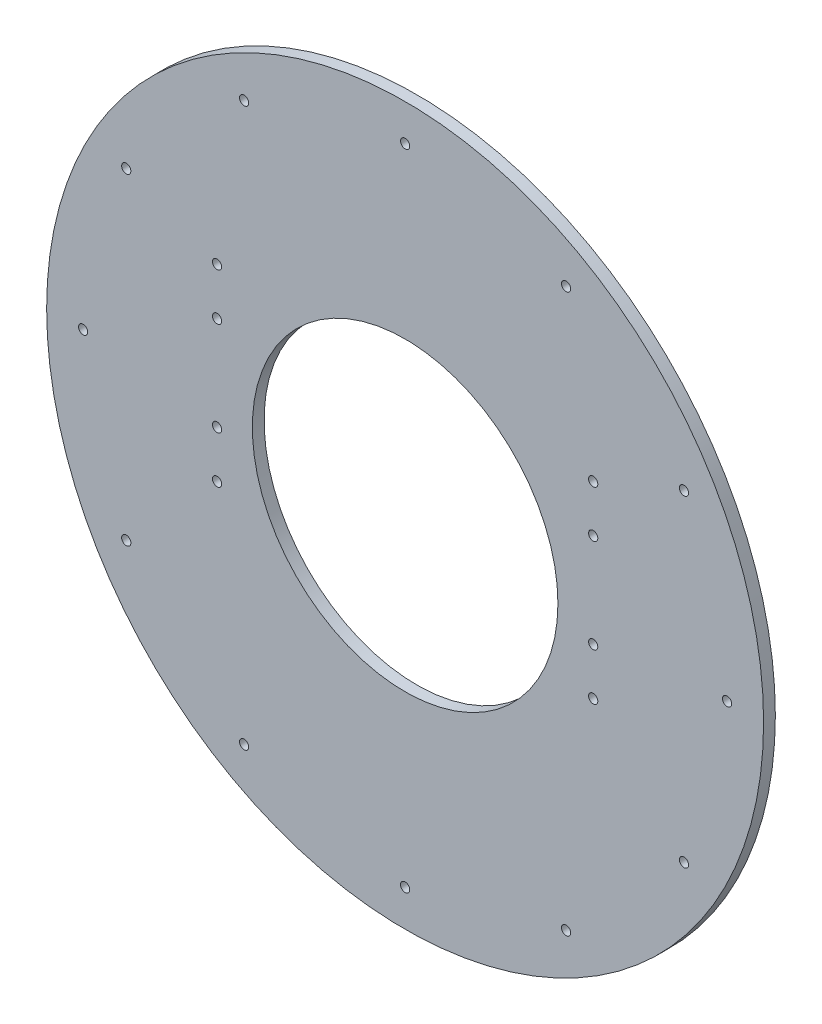
from build123d import *

# Parameters (mm, degrees)
SKETCH1_R                  = 193.675
BOSS_EXTRUDE1_DEPTH        = 6.35
F_9_0_196_DIAMETER_HOLE1_D = 4.9784
SKETCH5_R                  = 82.55
CUT_EXTRUDE1_DEPTH         = 6.35
F_9_0_196_DIAMETER_HOLE2_D = 4.9784


with BuildPart() as part:
    # Sketch1 → Boss-Extrude1 (new body)
    with BuildSketch(Plane(origin=(0, 0, 0), x_dir=(0, 1, 0), z_dir=(0, 0, 1))):
        with Locations(Location((0, 0, 0), (0, 0, 270))):
            Circle(SKETCH1_R)
    extrude(amount=BOSS_EXTRUDE1_DEPTH)

    # #9 (0.196) Diameter Hole1 (through all)
    with Locations(Plane.XY.offset(6.35)):
        with Locations((-150.657762959, 86.9823), (-173.9646, 0), (-150.657762959, -86.9823), (-86.9823, -150.657762959), (0, -173.9646), (86.9823, -150.657762959), (150.657762959, -86.9823), (173.9646, 0), (150.657762959, 86.9823), (86.9823, 150.657762959), (0, 173.9646), (-86.9823, 150.657762959)):
            Hole(F_9_0_196_DIAMETER_HOLE1_D / 2)

    # Sketch5 → Cut-Extrude1 (cut)
    with BuildSketch(Plane.XY.offset(6.35)):
        Circle(SKETCH5_R)
    extrude(amount=-CUT_EXTRUDE1_DEPTH, mode=Mode.SUBTRACT)

    # #9 (0.196) Diameter Hole2 (through all)
    with Locations(Plane.XY.offset(6.35)):
        with Locations((101.6, 66.675), (101.6, 41.275), (101.6, -9.525), (101.6, -34.925), (-101.6, -34.925), (-101.6, -9.525), (-101.6, 41.275), (-101.6, 66.675)):
            Hole(F_9_0_196_DIAMETER_HOLE2_D / 2)


solid = part.part
